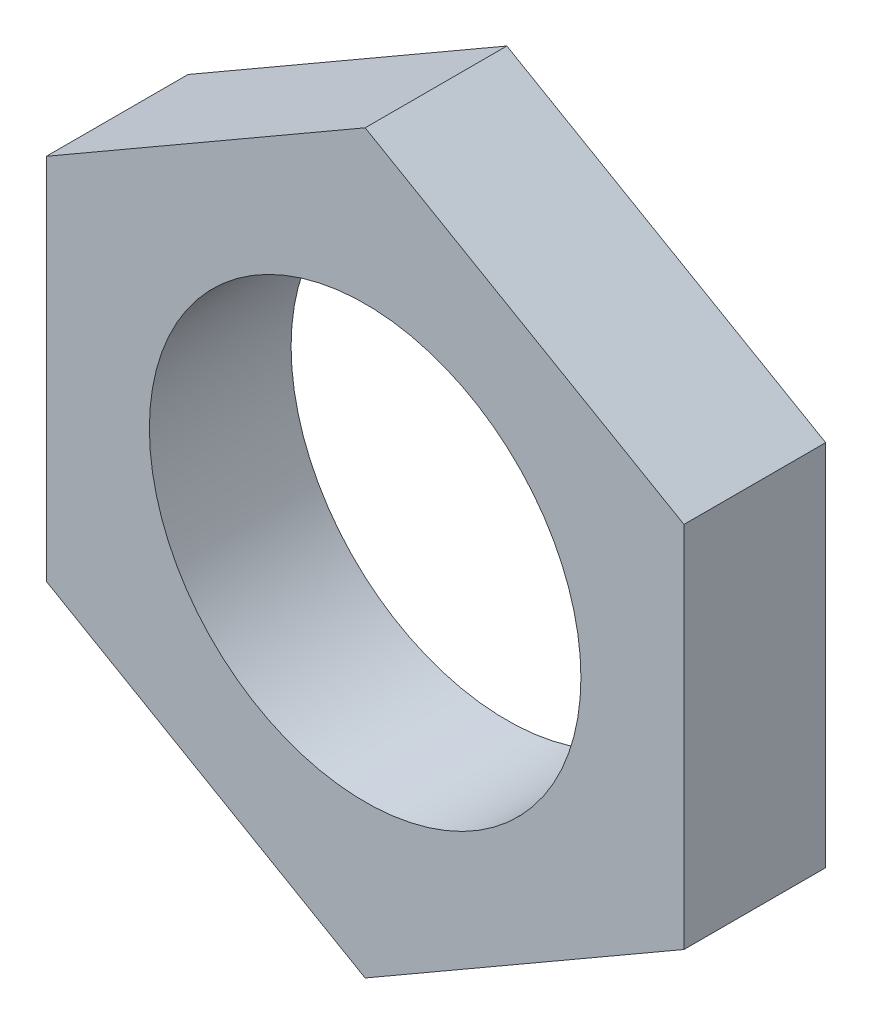
from build123d import *

# Parameters (mm, degrees)
SKETCH_1_R      = 3.35
EXTRUDE_1_DEPTH = 2.2


with BuildPart() as part:
    # 草图1 → 凸台-拉伸1 (new body)
    with BuildSketch(Plane.XY):
        Polygon((0, 5.715767665), (-4.95, 2.857883832), (-4.95, -2.857883832), (0, -5.715767665), (4.95, -2.857883832), (4.95, 2.857883832), align=None)
        Circle(SKETCH_1_R, mode=Mode.SUBTRACT)
    extrude(amount=EXTRUDE_1_DEPTH)


solid = part.part
